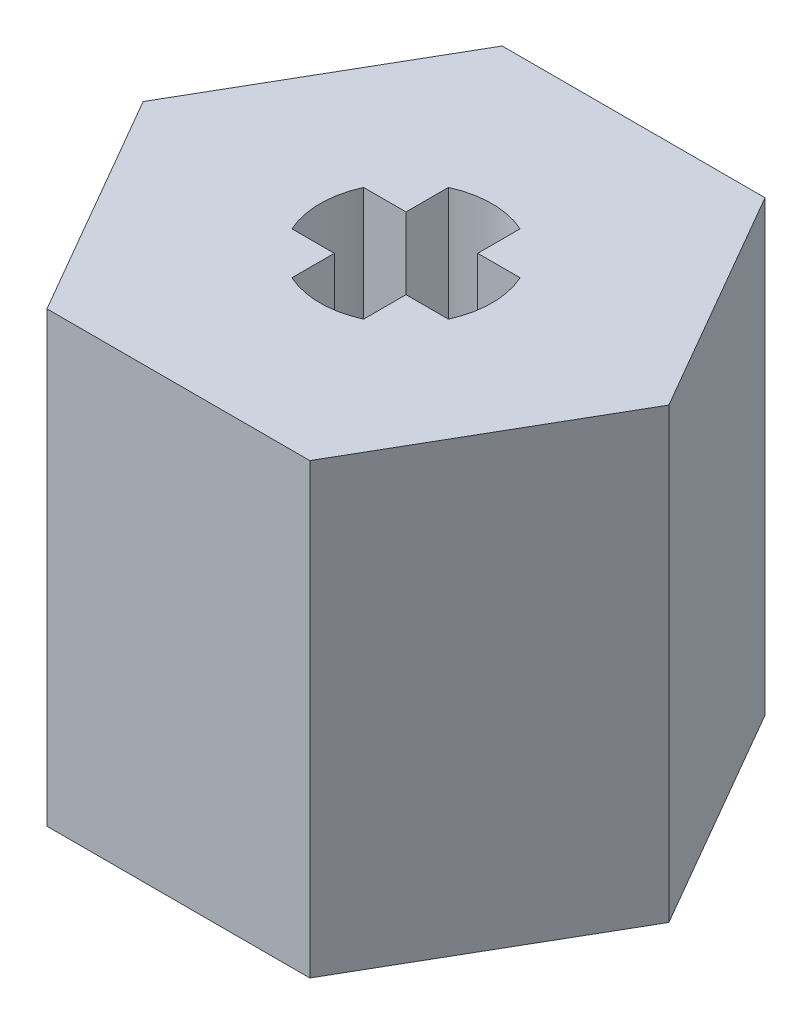
from build123d import *

# Parameters (mm, degrees)
SKETCH1_R           = 2.4
BOSS_EXTRUDE1_DEPTH = 12.5


with BuildPart() as part:
    # Sketch1 → Boss-Extrude1 (new body)
    # profile 1 of 5: a face of its own
    with BuildSketch(Plane(origin=(0, 0, 0), x_dir=(1, 0, 0), z_dir=(0, 1, 0))):
        Polygon((-3.666174209, -6.35), (3.666174209, -6.35), (7.332348419, 0), (3.666174209, 6.35), (-3.666174209, 6.35), (-7.332348419, 0), align=None)
        Circle(SKETCH1_R, mode=Mode.SUBTRACT)
    # profile 2 of 5: a face of its own
    with BuildSketch(Plane(origin=(0, 0, 0), x_dir=(1, 0, 0), z_dir=(0, 1, 0))):
        with BuildLine():
            Line((-2.181742423, 1), (-1, 1))
            Line((-1, 1), (-1, 2.181742423))
            ThreePointArc((-1, 2.181742423), (-1.697056275, 1.697056275), (-2.181742423, 1))
        make_face()
    # profile 3 of 5: a face of its own
    with BuildSketch(Plane(origin=(0, 0, 0), x_dir=(1, 0, 0), z_dir=(0, 1, 0))):
        with BuildLine():
            Line((-1, -2.181742423), (-1, -1))
            Line((-1, -1), (-2.181742423, -1))
            ThreePointArc((-2.181742423, -1), (-1.697056275, -1.697056275), (-1, -2.181742423))
        make_face()
    # profile 4 of 5: a face of its own
    with BuildSketch(Plane(origin=(0, 0, 0), x_dir=(1, 0, 0), z_dir=(0, 1, 0))):
        with BuildLine():
            Line((2.181742423, -1), (1, -1))
            Line((1, -1), (1, -2.181742423))
            ThreePointArc((1, -2.181742423), (1.697056275, -1.697056275), (2.181742423, -1))
        make_face()
    # profile 5 of 5: a face of its own
    with BuildSketch(Plane(origin=(0, 0, 0), x_dir=(1, 0, 0), z_dir=(0, 1, 0))):
        with BuildLine():
            Line((1, 2.181742423), (1, 1))
            Line((1, 1), (2.181742423, 1))
            ThreePointArc((2.181742423, 1), (1.697056275, 1.697056275), (1, 2.181742423))
        make_face()
    extrude(amount=BOSS_EXTRUDE1_DEPTH)


solid = part.part
